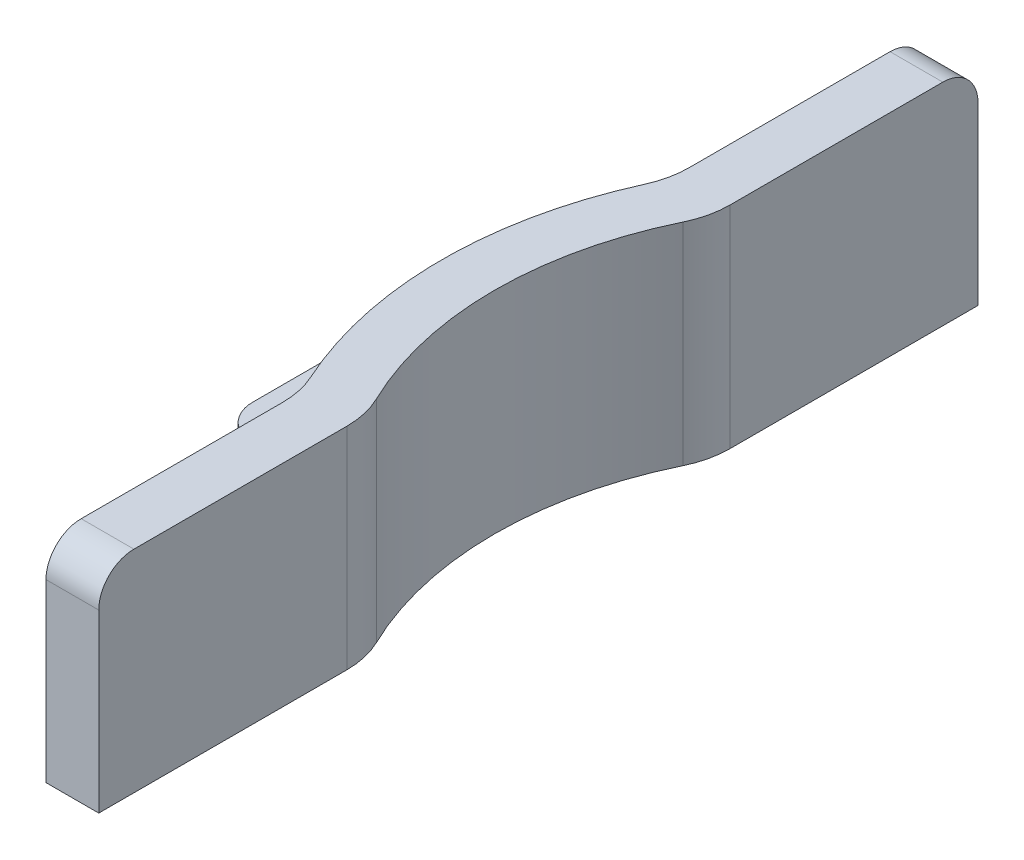
from build123d import *

# Parameters (mm, degrees)
BOSS_EXTRUDE2_DEPTH = 12
FILLET2_R           = 5
FILLET3_R           = 2
SKETCH2_W           = 8
SKETCH2_H           = 10.766845602
SKETCH2_R           = 1.5
BOSS_EXTRUDE3_DEPTH = 3
FILLET4_R           = 2


with BuildPart() as part:
    # Sketch1 → Boss-Extrude2 (new body)
    with BuildSketch(Plane(origin=(0, 0, 0), x_dir=(1, 0, 0), z_dir=(0, 1, 0))):
        with BuildLine():
            Line((-17.5, 25), (-20.5, 25))
            Line((-20.5, 25), (-20.5, 10.428326807))
            ThreePointArc((-20.5, 10.428326807), (-19.132553248, 12.765007099), (-17.5, 14.924811557))
            Line((-17.5, 14.924811557), (-17.5, 25))
        make_face()
        with BuildLine():
            ThreePointArc((-17.5, 14.924811557), (-19.132553248, 12.765007099), (-20.5, 10.428326807))
            Line((-20.5, 10.428326807), (-20.5, -10.428326807))
            ThreePointArc((-20.5, -10.428326807), (-19.132553248, -12.765007099), (-17.5, -14.924811557))
            Line((-17.5, -14.924811557), (-17.5, -9.682458366))
            ThreePointArc((-17.5, -9.682458366), (-20, 0), (-17.5, 9.682458366))
            Line((-17.5, 9.682458366), (-17.5, 14.924811557))
        make_face()
        with BuildLine():
            Line((-20.5, -10.428326807), (-20.5, 10.428326807))
            ThreePointArc((-20.5, 10.428326807), (-23, 0), (-20.5, -10.428326807))
        make_face()
        with BuildLine():
            ThreePointArc((-17.5, -14.924811557), (-19.132553248, -12.765007099), (-20.5, -10.428326807))
            Line((-20.5, -10.428326807), (-20.5, -25))
            Line((-20.5, -25), (-17.5, -25))
            Line((-17.5, -25), (-17.5, -14.924811557))
        make_face()
    extrude(amount=BOSS_EXTRUDE2_DEPTH)

    # Fillet2
    fillet2_edges = [part.edges().sort_by_distance(p)[0] for p in [
        (-17.5, 6, -9.682458366),
        (-17.5, 6, 9.682458366),
        (-20.5, 6, 10.428326807),
        (-20.5, 6, -10.428326807),
    ]]
    fillet(fillet2_edges, radius=FILLET2_R)

    # Fillet3
    fillet3_edges = [part.edges().sort_by_distance(p)[0] for p in [
        (-19, 12, 25),
        (-19, 12, -25),
    ]]
    fillet(fillet3_edges, radius=FILLET3_R)

    # Sketch2 → Boss-Extrude3 (add)
    with BuildSketch(Plane(origin=(0, 0, 0), x_dir=(1, 0, 0), z_dir=(0, 1, 0))):
        with Locations((-26.361099234, 0)):
            Rectangle(SKETCH2_W, SKETCH2_H)
        with Locations(Location((-26.361099234, 0, 0), (0, 0, 270))):
            Circle(SKETCH2_R, mode=Mode.SUBTRACT)
    extrude(amount=BOSS_EXTRUDE3_DEPTH)

    # Fillet4
    fillet4_edges = [part.edges().sort_by_distance(p)[0] for p in [
        (-23, 3, 0),
        (-30.361099234, 1.5, -5.383422801),
        (-30.361099234, 1.5, 5.383422801),
        (-22.361099234, 1.5, 5.383422801),
        (-22.361099234, 1.5, -5.383422801),
    ]]
    fillet(fillet4_edges, radius=FILLET4_R)


solid = part.part
